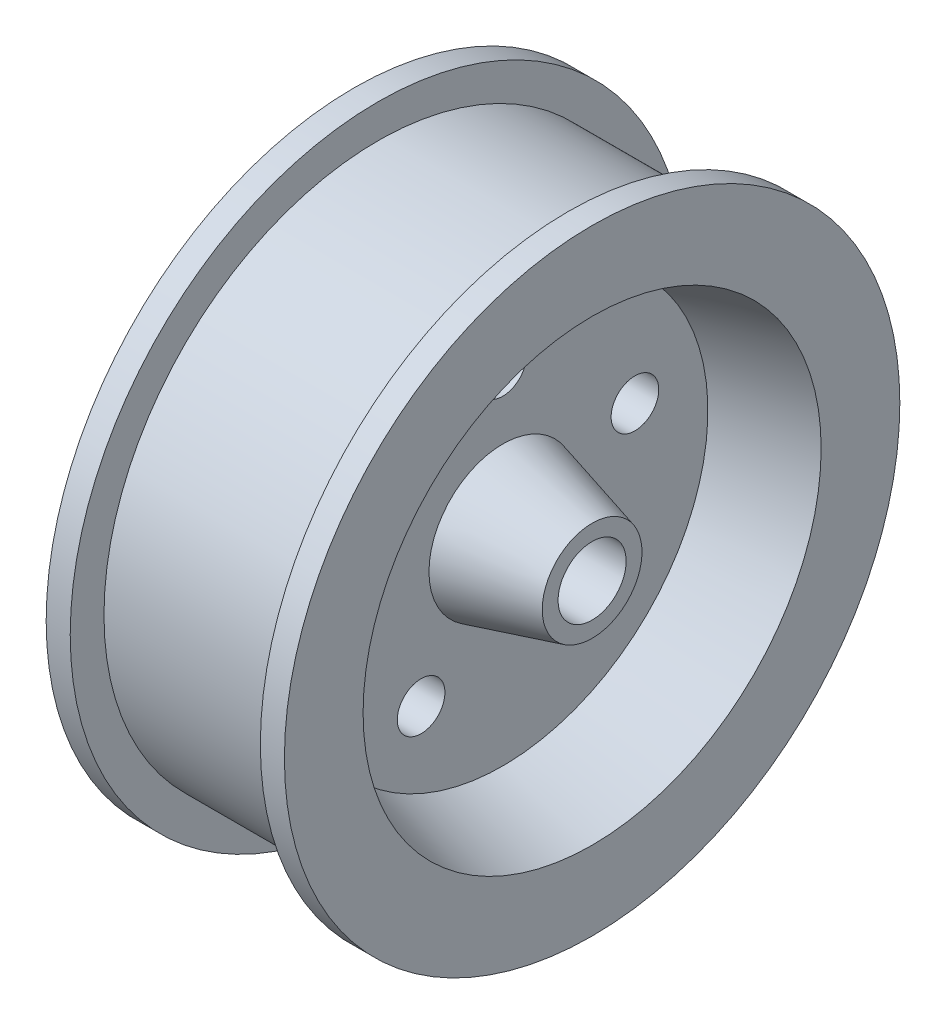
from build123d import *

# Parameters (mm, degrees)
ESBO_O2_R             = 7.62
CORTE_EXTRUS_O1_DEPTH = 162
PADR_OCIRCULAR1_COUNT = 5


with BuildPart() as part:
    # Esboço1 → Revolução1 (revolve)
    with BuildSketch(Plane.XY, mode=Mode.PRIVATE) as revolu_o1_sk:
        Polygon((0, 10.885714286), (76.2, 10.885714286), (76.2, 15.95320197), (47.625, 23.609850144), (47.625, 65.598953797), (76.2, 73.25560197), (76.2, 98.425), (68.504926108, 98.425), (68.504926108, 87.63), (7.695073892, 87.63), (7.695073892, 98.425), (0, 98.425), (0, 73.25560197), (28.575, 65.598953797), (28.575, 23.609850144), (0, 15.95320197), align=None)
    revolve(revolu_o1_sk.sketch.rotate(Axis((0, 0, 0), (1, 0, 0)), 90), axis=Axis((0, 0, 0), (1, 0, 0)))

    # Esboço2 → Corte-extrusão1 (cut)
    with BuildSketch(Plane.ZY.offset(-28.575)):
        with Locations((0, 44.45)):
            Circle(ESBO_O2_R)
    corte_extrus_o1 = extrude(amount=-CORTE_EXTRUS_O1_DEPTH, mode=Mode.SUBTRACT)

    # PadrãoCircular1: Corte-extrusão1 ×5 about axis
    padr_ocircular1_axis = Axis((0, 0, 0), (1, 0, 0))
    for i in range(1, PADR_OCIRCULAR1_COUNT):
        add(corte_extrus_o1.rotate(padr_ocircular1_axis, i * 360 / PADR_OCIRCULAR1_COUNT), mode=Mode.SUBTRACT)


solid = part.part
